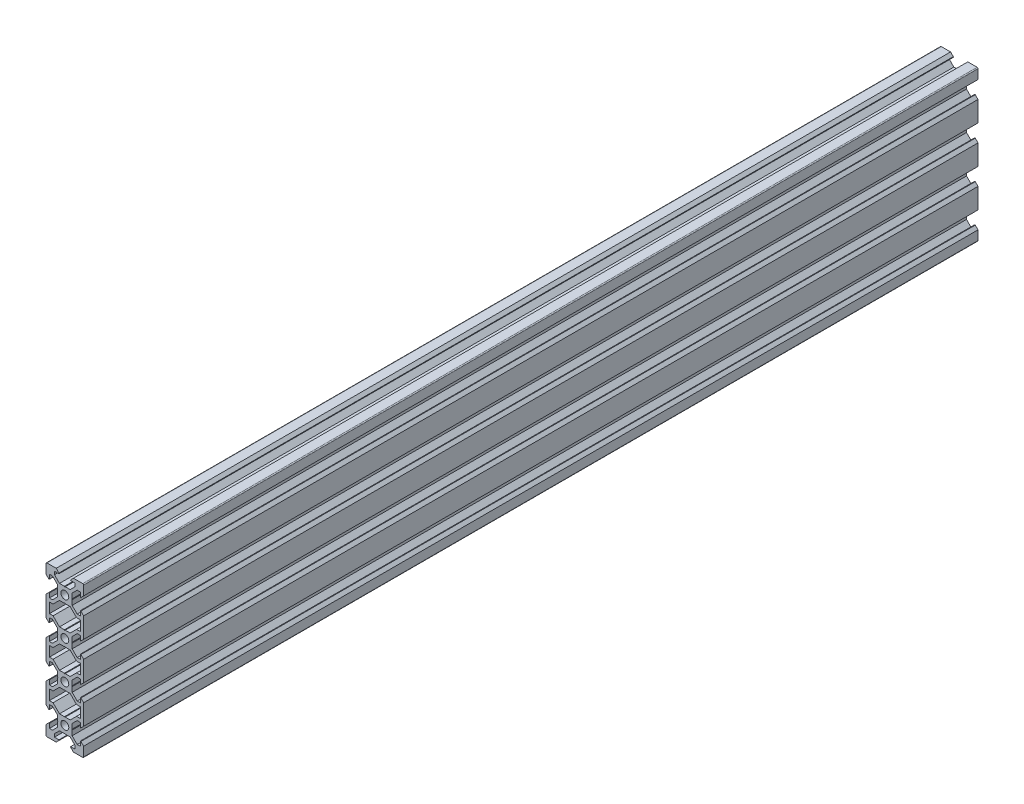
from build123d import *

# Parameters (mm, degrees)
BOSS_EXTRU_1_DEPTH = 475.2


with BuildPart() as part:
    # Esquisse1 → Boss.-Extru.1 (new body)
    with BuildSketch(Plane.XY):
        with BuildLine():
            Line((-9.5, 10), (-4.58, 10))
            Line((-4.58, 10), (-3.125, 8.545))
            Line((-3.125, 8.545), (-3.125, 8.2))
            Line((-3.125, 8.2), (-5.5, 8.2))
            Line((-5.5, 8.2), (-5.5, 6.560660172))
            Line((-5.5, 6.560660172), (-2.839339828, 3.9))
            Line((-2.839339828, 3.9), (-0.21, 3.9))
            Line((-0.21, 3.9), (0, 3.69))
            Line((0, 3.69), (0, 2.1))
            ThreePointArc((0, 2.1), (-2.1, 0), (0, -2.1))
            Line((0, -2.1), (0, -3.69))
            Line((0, -3.69), (-0.21, -3.9))
            Line((-0.21, -3.9), (-2.839339828, -3.9))
            Line((-2.839339828, -3.9), (-6.239339828, -7.3))
            Line((-6.239339828, -7.3), (-8.2, -7.3))
            Line((-8.2, -7.3), (-8.2, -12.7))
            Line((-8.2, -12.7), (-6.239339828, -12.7))
            Line((-6.239339828, -12.7), (-2.839339828, -16.1))
            Line((-2.839339828, -16.1), (-0.21, -16.1))
            Line((-0.21, -16.1), (0, -16.31))
            Line((0, -16.31), (0, -17.9))
            ThreePointArc((0, -17.9), (-2.1, -20), (0, -22.1))
            Line((0, -22.1), (0, -23.69))
            Line((0, -23.69), (-0.21, -23.9))
            Line((-0.21, -23.9), (-2.839339828, -23.9))
            Line((-2.839339828, -23.9), (-6.239339828, -27.3))
            Line((-6.239339828, -27.3), (-8.2, -27.3))
            Line((-8.2, -27.3), (-8.2, -32.7))
            Line((-8.2, -32.7), (-6.239339828, -32.7))
            Line((-6.239339828, -32.7), (-2.839339828, -36.1))
            Line((-2.839339828, -36.1), (-0.21, -36.1))
            Line((-0.21, -36.1), (0, -36.31))
            Line((0, -36.31), (0, -37.9))
            ThreePointArc((0, -37.9), (-2.1, -40), (0, -42.1))
            Line((0, -42.1), (0, -43.69))
            Line((0, -43.69), (-0.21, -43.9))
            Line((-0.21, -43.9), (-2.839339828, -43.9))
            Line((-2.839339828, -43.9), (-6.239339828, -47.3))
            Line((-6.239339828, -47.3), (-8.2, -47.3))
            Line((-8.2, -47.3), (-8.2, -52.7))
            Line((-8.2, -52.7), (-6.239339828, -52.7))
            Line((-6.239339828, -52.7), (-2.839339828, -56.1))
            Line((-2.839339828, -56.1), (-0.21, -56.1))
            Line((-0.21, -56.1), (0, -56.31))
            Line((0, -56.31), (0, -57.9))
            ThreePointArc((0, -57.9), (-2.1, -60), (0, -62.1))
            Line((0, -62.1), (0, -63.69))
            Line((0, -63.69), (-0.21, -63.9))
            Line((-0.21, -63.9), (-2.839339828, -63.9))
            Line((-2.839339828, -63.9), (-5.5, -66.560660172))
            Line((-5.5, -66.560660172), (-5.5, -68.2))
            Line((-5.5, -68.2), (-3.125, -68.2))
            Line((-3.125, -68.2), (-3.125, -68.545))
            Line((-3.125, -68.545), (-4.58, -70))
            Line((-4.58, -70), (-9.5, -70))
            ThreePointArc((-9.5, -70), (-9.853553391, -69.853553391), (-10, -69.5))
            Line((-10, -69.5), (-10, -64.58))
            Line((-10, -64.58), (-8.545, -63.125))
            Line((-8.545, -63.125), (-8.2, -63.125))
            Line((-8.2, -63.125), (-8.2, -65.5))
            Line((-8.2, -65.5), (-6.560660172, -65.5))
            Line((-6.560660172, -65.5), (-3.9, -62.839339828))
            Line((-3.9, -62.839339828), (-3.9, -60.21))
            Line((-3.9, -60.21), (-3.69, -60))
            Line((-3.69, -60), (-3.9, -59.79))
            Line((-3.9, -59.79), (-3.9, -57.160660172))
            Line((-3.9, -57.160660172), (-6.560660172, -54.5))
            Line((-6.560660172, -54.5), (-8.2, -54.5))
            Line((-8.2, -54.5), (-8.2, -56.875))
            Line((-8.2, -56.875), (-8.545, -56.875))
            Line((-8.545, -56.875), (-10, -55.42))
            Line((-10, -55.42), (-10, -44.58))
            Line((-10, -44.58), (-8.545, -43.125))
            Line((-8.545, -43.125), (-8.2, -43.125))
            Line((-8.2, -43.125), (-8.2, -45.5))
            Line((-8.2, -45.5), (-6.560660172, -45.5))
            Line((-6.560660172, -45.5), (-3.9, -42.839339828))
            Line((-3.9, -42.839339828), (-3.9, -40.21))
            Line((-3.9, -40.21), (-3.69, -40))
            Line((-3.69, -40), (-3.9, -39.79))
            Line((-3.9, -39.79), (-3.9, -37.160660172))
            Line((-3.9, -37.160660172), (-6.560660172, -34.5))
            Line((-6.560660172, -34.5), (-8.2, -34.5))
            Line((-8.2, -34.5), (-8.2, -36.875))
            Line((-8.2, -36.875), (-8.545, -36.875))
            Line((-8.545, -36.875), (-10, -35.42))
            Line((-10, -35.42), (-10, -24.58))
            Line((-10, -24.58), (-8.545, -23.125))
            Line((-8.545, -23.125), (-8.2, -23.125))
            Line((-8.2, -23.125), (-8.2, -25.5))
            Line((-8.2, -25.5), (-6.560660172, -25.5))
            Line((-6.560660172, -25.5), (-3.9, -22.839339828))
            Line((-3.9, -22.839339828), (-3.9, -20.21))
            Line((-3.9, -20.21), (-3.69, -20))
            Line((-3.69, -20), (-3.9, -19.79))
            Line((-3.9, -19.79), (-3.9, -17.160660172))
            Line((-3.9, -17.160660172), (-6.560660172, -14.5))
            Line((-6.560660172, -14.5), (-8.2, -14.5))
            Line((-8.2, -14.5), (-8.2, -16.875))
            Line((-8.2, -16.875), (-8.545, -16.875))
            Line((-8.545, -16.875), (-10, -15.42))
            Line((-10, -15.42), (-10, -4.58))
            Line((-10, -4.58), (-8.545, -3.125))
            Line((-8.545, -3.125), (-8.2, -3.125))
            Line((-8.2, -3.125), (-8.2, -5.5))
            Line((-8.2, -5.5), (-6.560660172, -5.5))
            Line((-6.560660172, -5.5), (-3.9, -2.839339828))
            Line((-3.9, -2.839339828), (-3.9, -0.21))
            Line((-3.9, -0.21), (-3.69, 0))
            Line((-3.69, 0), (-3.9, 0.21))
            Line((-3.9, 0.21), (-3.9, 2.839339828))
            Line((-3.9, 2.839339828), (-6.560660172, 5.5))
            Line((-6.560660172, 5.5), (-8.2, 5.5))
            Line((-8.2, 5.5), (-8.2, 3.125))
            Line((-8.2, 3.125), (-8.545, 3.125))
            Line((-8.545, 3.125), (-10, 4.58))
            Line((-10, 4.58), (-10, 9.5))
            ThreePointArc((-10, 9.5), (-9.853553391, 9.853553391), (-9.5, 10))
        make_face()
    boss_extru_1 = extrude(amount=BOSS_EXTRU_1_DEPTH)

    # Symétrie1: Boss.-Extru.1 across plane
    add(boss_extru_1.mirror(Plane(origin=(0, 3.69, 475.2), x_dir=(0, 0, 1), z_dir=(-1, 0, 0))))


solid = part.part
